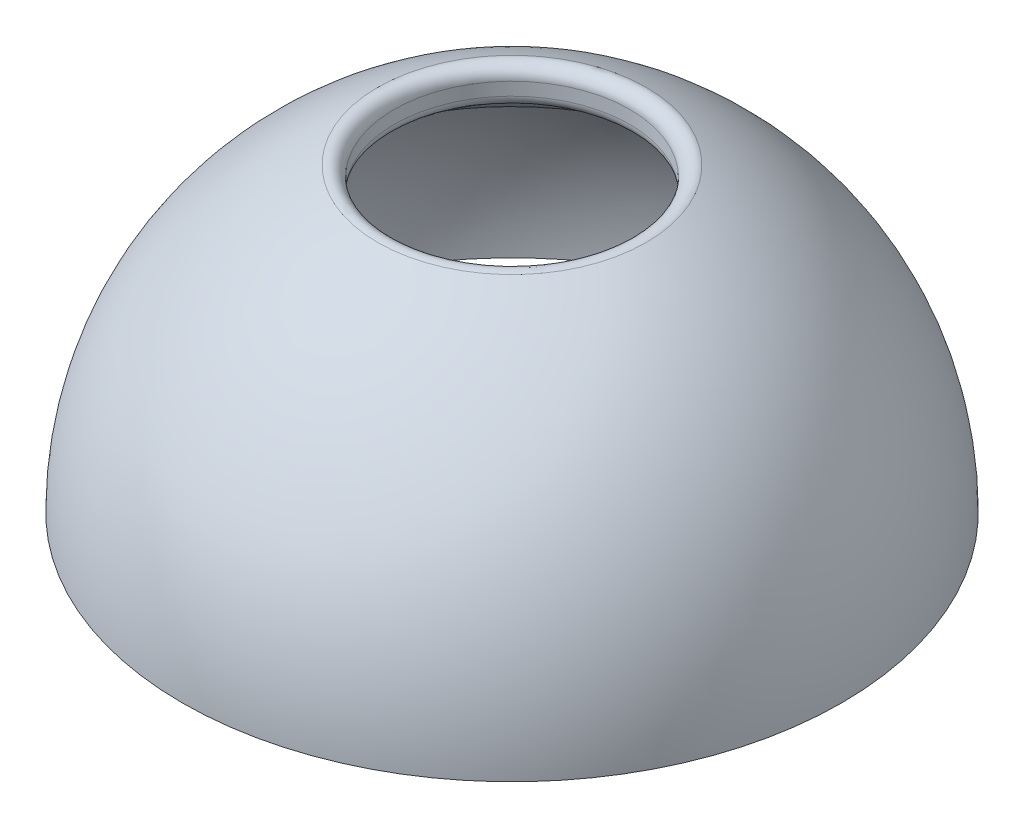
from build123d import *

# Parameters (mm, degrees)
CROQUIS2_W            = 10
CROQUIS2_H            = 14
REDONDEO1_R           = 1
CROQUIS3_R            = 29.845650159
CORTAR_EXTRUIR1_DEPTH = 30


with BuildPart() as part:
    # Croquis1 → Revolución3 (revolve)
    with BuildSketch(Plane(origin=(0, 0, 0), x_dir=(0, 0, -1), z_dir=(1, 0, 0))):
        with BuildLine():
            Line((-0.5, 27.995535358), (-0.5, 26.495282599))
            Line((-0.5, 26.495282599), (-0.5, 24.9949995))
            ThreePointArc((-0.5, 24.9949995), (-10.791516482, 22.5509018), (-19.151111078, 16.069690242))
            Line((-19.151111078, 16.069690242), (-20.300177743, 17.033871657))
            ThreePointArc((-20.300177743, 17.033871657), (-24.017156356, -11.199383936), (0, -26.5))
            Line((0, -26.5), (0, -28))
            ThreePointArc((0, -28), (-27.998883817, -0.250009966), (-0.5, 27.995535358))
        make_face()
    revolve(axis=Axis((0, 29, 0), (0, -1, 0)))

    # Croquis2 → Cortar-Revolución2 (revolve, cut)
    with BuildSketch(Plane(origin=(0, 0, 0), x_dir=(0, 0, -1), z_dir=(1, 0, 0))):
        with Locations((-5, 23)):
            Rectangle(CROQUIS2_W, CROQUIS2_H)
    revolve(axis=Axis((0, 0, 0), (0, 1, 0)), mode=Mode.SUBTRACT)

    # Redondeo1
    redondeo1_edges = [part.edges().sort_by_distance(p)[0] for p in [
        (0, 22.912878475, -10),
        (0, 26.153393661, -10),
        (0, 16.069690242, -19.151111078),
    ]]
    fillet(redondeo1_edges, radius=REDONDEO1_R)

    # Croquis3 → Cortar-Extruir1 (cut)
    with BuildSketch(Plane(origin=(0, 0, 0), x_dir=(1, 0, 0), z_dir=(0, 1, 0))):
        Circle(CROQUIS3_R)
    extrude(amount=-CORTAR_EXTRUIR1_DEPTH, mode=Mode.SUBTRACT)


solid = part.part
